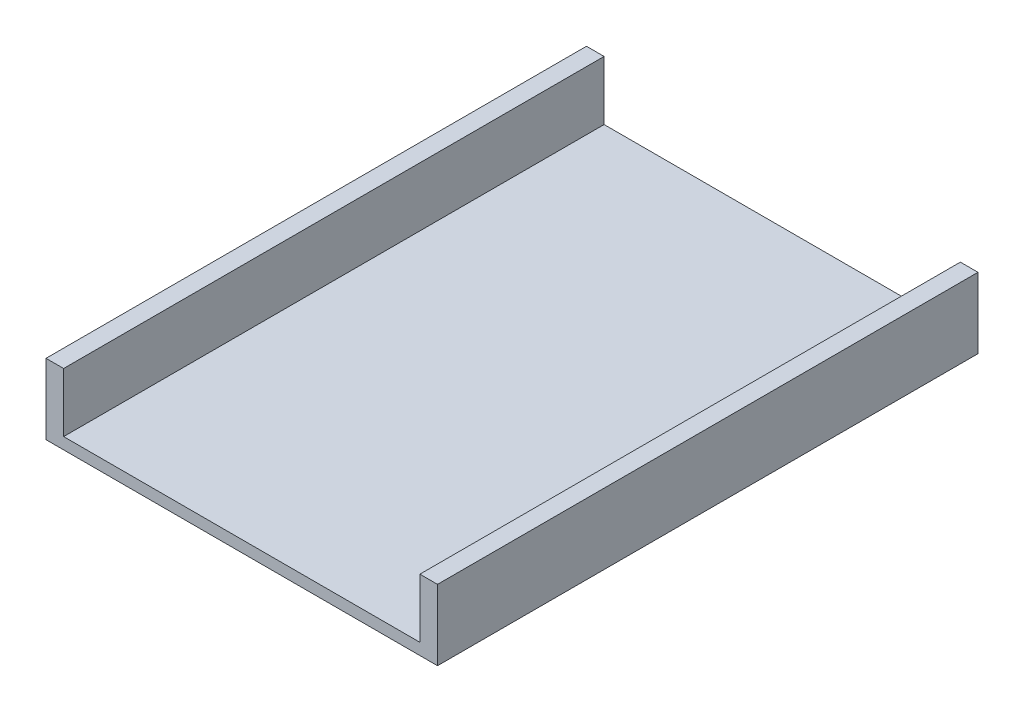
from build123d import *

# Parameters (mm, degrees)
BOSS_EXTRUDE1_DEPTH = 584.2


with BuildPart() as part:
    # Sketch1 → Boss-Extrude1 (new body)
    with BuildSketch(Plane.XY):
        Polygon((-36.046706587, 56.750748503), (-16.996706587, 56.750748503), (-16.996706587, -7.003251497), (368.067293413, -7.003251497), (368.067293413, 56.750748503), (387.117293413, 56.750748503), (387.117293413, -19.449251497), (65.363173653, -19.449251497), (-36.046706587, -19.449251497), align=None)
    extrude(amount=BOSS_EXTRUDE1_DEPTH)


solid = part.part
